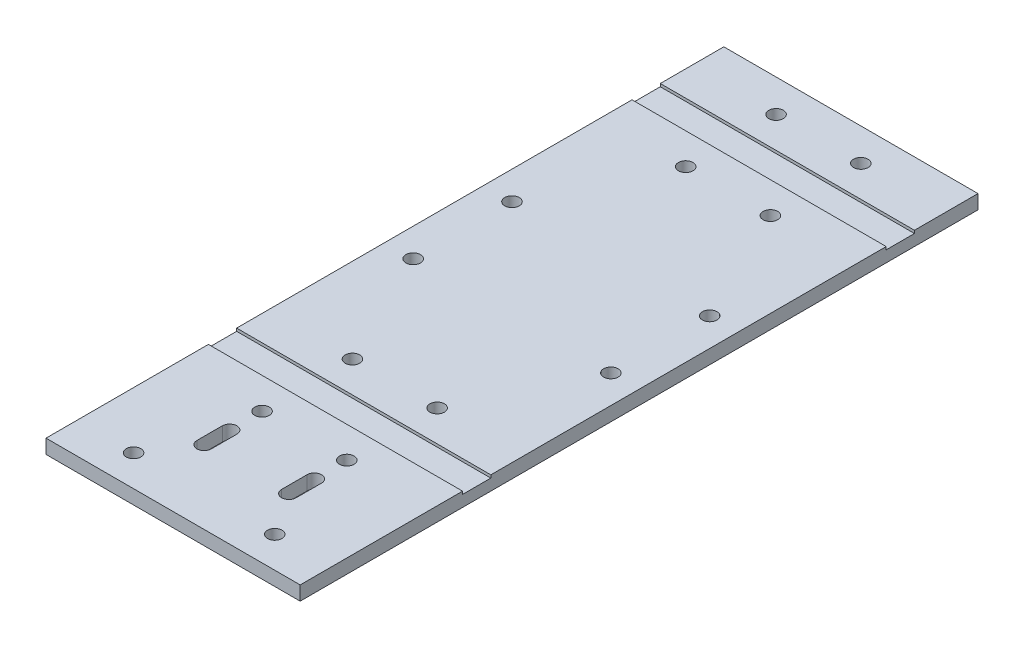
from build123d import *

# Parameters (mm, degrees)
SKETCH1_W           = 45
SKETCH1_H           = 5
BOSS_EXTRUDE1_DEPTH = 102.5
SKETCH2_R           = 2.575
CUT_EXTRUDE1_DEPTH  = 106.059506947
SKETCH3_W           = 10
SKETCH3_H           = 1
CUT_EXTRUDE2_DEPTH  = 112.970978383
SKETCH4_W           = 45
SKETCH4_H           = 5
BOSS_EXTRUDE2_DEPTH = 35
BOSS_EXTRUDE3_DEPTH = 22.5
SKETCH6_R           = 2.575
CUT_EXTRUDE3_DEPTH  = 145.762736918
SKETCH7_R           = 2.575
CUT_EXTRUDE4_DEPTH  = 145.762736918
CUT_EXTRUDE5_DEPTH  = 145.762736918


with BuildPart() as part:
    # Sketch1 → Boss-Extrude1 (new body)
    with BuildSketch(Plane.XY):
        Rectangle(SKETCH1_W, SKETCH1_H)
    boss_extrude1 = extrude(amount=BOSS_EXTRUDE1_DEPTH)

    # Sketch2 → Cut-Extrude1 (cut, through all)
    with BuildSketch(Plane(origin=(0, 2.5, 0), x_dir=(1, 0, 0), z_dir=(0, 1, 0))):
        with Locations(Location((-15, -59, 0), (0, 0, 270))):
            Circle(SKETCH2_R)
        with Locations(Location((15, -59, 0), (0, 0, 270))):
            Circle(SKETCH2_R)
        with Locations(Location((-15, -91, 0), (0, 0, 270))):
            Circle(SKETCH2_R)
        with Locations(Location((15, -91, 0), (0, 0, 270))):
            Circle(SKETCH2_R)
    cut_extrude1 = extrude(amount=-CUT_EXTRUDE1_DEPTH, mode=Mode.SUBTRACT)

    # Sketch3 → Cut-Extrude2 (cut, through all)
    with BuildSketch(Plane(origin=(22.5, 0, 0), x_dir=(0, 0, -1), z_dir=(1, 0, 0))):
        with Locations((-75, 2)):
            Rectangle(SKETCH3_W, SKETCH3_H)
    cut_extrude2 = extrude(amount=-CUT_EXTRUDE2_DEPTH, mode=Mode.SUBTRACT)

    # Mirror1: Boss-Extrude1, Cut-Extrude1, Cut-Extrude2 across plane
    add(boss_extrude1.mirror(Plane.XY))
    add(cut_extrude1.mirror(Plane.XY), mode=Mode.SUBTRACT)
    add(cut_extrude2.mirror(Plane.XY), mode=Mode.SUBTRACT)

    # Sketch4 → Boss-Extrude2 (add)
    with BuildSketch(Plane.XY.offset(102.5)):
        Rectangle(SKETCH4_W, SKETCH4_H)
    extrude(amount=BOSS_EXTRUDE2_DEPTH)

    # Sketch5 → Boss-Extrude3 (add)
    with BuildSketch(Plane(origin=(22.5, 0, 0), x_dir=(0, 0, -1), z_dir=(1, 0, 0))):
        Polygon((70, 1.5), (70, 2.5), (-70, 2.5), (-70, 1.5), (-80, 1.5), (-80, 2.5), (-137.5, 2.5), (-137.5, -2.5), (102.5, -2.5), (102.5, 2.5), (80, 2.5), (80, 1.5), align=None)
    boss_extrude3 = extrude(amount=BOSS_EXTRUDE3_DEPTH)

    # Mirror2: Boss-Extrude3 across plane
    add(boss_extrude3.mirror(Plane(origin=(0, 0, 0), x_dir=(0, 0, 1), z_dir=(1, 0, 0))))

    # Sketch6 → Cut-Extrude3 (cut, through all)
    with BuildSketch(Plane(origin=(0, 2.5, 0), x_dir=(1, 0, 0), z_dir=(0, 1, 0))):
        with Locations(Location((-35, -17.5, 0), (0, 0, 270))):
            Circle(SKETCH6_R)
        with Locations(Location((-35, 17.5, 0), (0, 0, 270))):
            Circle(SKETCH6_R)
    cut_extrude3 = extrude(amount=-CUT_EXTRUDE3_DEPTH, mode=Mode.SUBTRACT)

    # Mirror3: Cut-Extrude3 across plane
    add(cut_extrude3.mirror(Plane(origin=(0, 0, 0), x_dir=(0, 0, 1), z_dir=(1, 0, 0))), mode=Mode.SUBTRACT)

    # Sketch7 → Cut-Extrude4 (cut, through all)
    with BuildSketch(Plane(origin=(0, 2.5, 0), x_dir=(1, 0, 0), z_dir=(0, 1, 0))):
        with Locations(Location((-25, -126.5, 0), (0, 0, 270))):
            Circle(SKETCH7_R)
        with Locations(Location((25, -126.5, 0), (0, 0, 90))):
            Circle(SKETCH7_R)
    extrude(amount=-CUT_EXTRUDE4_DEPTH, mode=Mode.SUBTRACT)

    # Sketch8 → Cut-Extrude5 (cut, through all)
    with BuildSketch(Plane(origin=(0, 2.5, 0), x_dir=(1, 0, 0), z_dir=(0, 1, 0))):
        with BuildLine():
            Line((-17.575, -111.5), (-17.575, -102.5))
            ThreePointArc((-17.575, -102.5), (-15, -99.925), (-12.425, -102.5))
            Line((-12.425, -102.5), (-12.425, -111.5))
            ThreePointArc((-12.425, -111.5), (-15, -114.075), (-17.575, -111.5))
        make_face()
        with BuildLine():
            Line((17.575, -111.5), (17.575, -102.5))
            ThreePointArc((17.575, -102.5), (15, -99.925), (12.425, -102.5))
            Line((12.425, -102.5), (12.425, -111.5))
            ThreePointArc((12.425, -111.5), (15, -114.075), (17.575, -111.5))
        make_face()
    extrude(amount=-CUT_EXTRUDE5_DEPTH, mode=Mode.SUBTRACT)


solid = part.part
